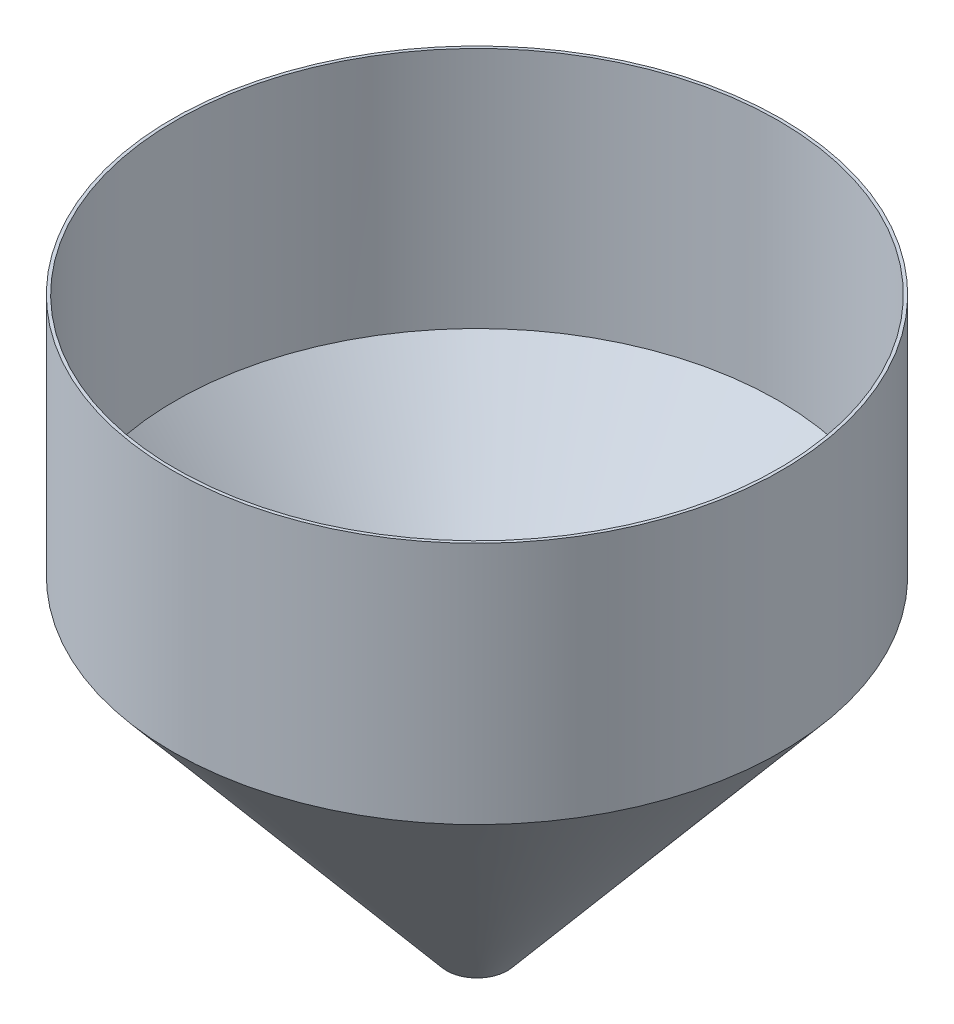
from build123d import *

# Parameters (mm, degrees)
SHELL1_T = -1


with BuildPart() as part:
    # Sketch1 → Revolve1 (revolve)
    with BuildSketch(Plane.XY, mode=Mode.PRIVATE) as revolve1_sk:
        Polygon((-100, 187.257823333), (-100, 107.257823333), (-10, 0), (0, 0), (0, 187.257823333), align=None)
    revolve(revolve1_sk.sketch.rotate(Axis((0, 0, 0), (0, 1, 0)), 90), axis=Axis((0, 0, 0), (0, 1, 0)))

    # Shell1
    shell1_openings = [part.faces().sort_by_distance(p)[0] for p in [
        (0, 0, 0),
        (0, 187.257823333, 0),
    ]]
    offset(amount=SHELL1_T, openings=shell1_openings, kind=Kind.INTERSECTION)


solid = part.part
